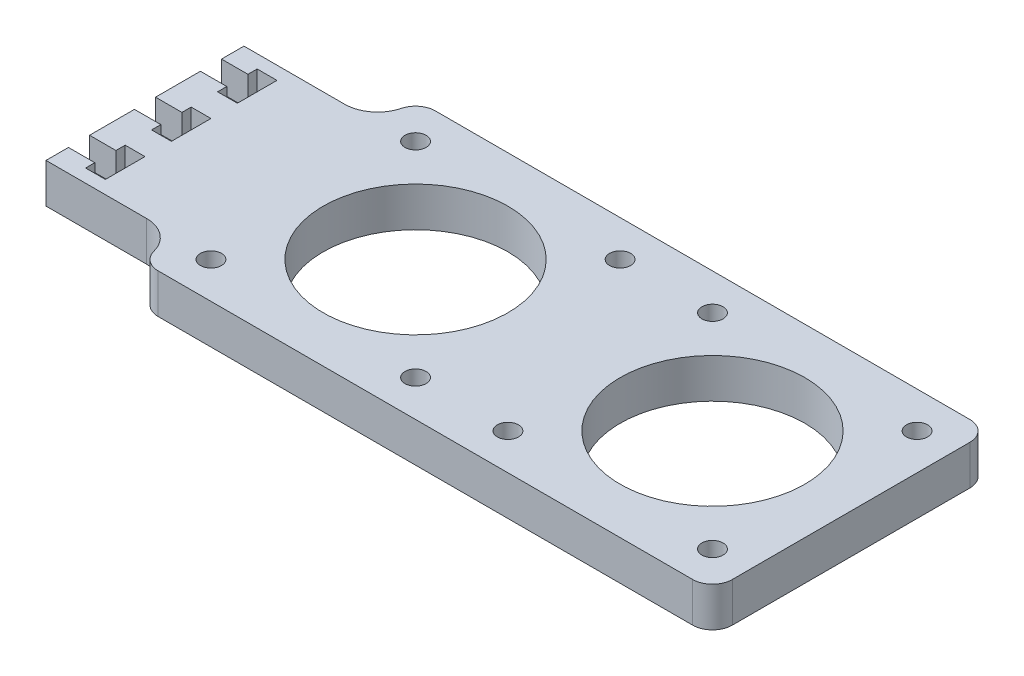
from build123d import *

# Parameters (mm, degrees)
SKETCH_1_W          = 20
SKETCH_1_H          = 30
EXTRUDE_1_DEPTH     = 6
SKETCH_2_W          = 4
SKETCH_2_H          = 3.2
CUT_EXTRUDE_1_DEPTH = 4.5
SKETCH_3_W          = 3
SKETCH_3_H          = 6
CUT_EXTRUDE_2_DEPTH = 14.5
SKETCH_4_W          = 87
SKETCH_4_H          = 42
SKETCH_4_R          = 1.6
SKETCH_4_R_2        = 14
EXTRUDE_2_DEPTH     = 6
FILLET_1_R          = 3
FILLET_2_R          = 5


with BuildPart() as part:
    # 草图1 → 凸台-拉伸1 (new body)
    with BuildSketch(Plane(origin=(0, 0, 0), x_dir=(1, 0, 0), z_dir=(0, 1, 0))):
        with Locations((10, 15)):
            Rectangle(SKETCH_1_W, SKETCH_1_H)
    extrude(amount=EXTRUDE_1_DEPTH)

    # 草图2 → 切除-拉伸1 (cut)
    with BuildSketch(Plane(origin=(0, 6, 0), x_dir=(1, 0, 0), z_dir=(0, 1, 0))):
        with Locations((2, 5)):
            Rectangle(SKETCH_2_W, SKETCH_2_H)
        with Locations((2, 15)):
            Rectangle(SKETCH_2_W, SKETCH_2_H)
        with Locations((2, 25)):
            Rectangle(SKETCH_2_W, SKETCH_2_H)
    extrude(amount=-CUT_EXTRUDE_1_DEPTH, mode=Mode.SUBTRACT)

    # 草图3 → 切除-拉伸2 (cut)
    with BuildSketch(Plane(origin=(0, 6, 0), x_dir=(1, 0, 0), z_dir=(0, 1, 0))):
        with Locations((5.5, 5)):
            Rectangle(SKETCH_3_W, SKETCH_3_H)
        with Locations((5.5, 15)):
            Rectangle(SKETCH_3_W, SKETCH_3_H)
        with Locations((5.5, 25)):
            Rectangle(SKETCH_3_W, SKETCH_3_H)
    extrude(amount=-CUT_EXTRUDE_2_DEPTH, mode=Mode.SUBTRACT)

    # 草图4 → 凸台-拉伸2 (add)
    with BuildSketch(Plane.XZ):
        with Locations((63.5, -15)):
            Rectangle(SKETCH_4_W, SKETCH_4_H)
        with Locations(Location((25.5, 0.5, 0), (0, 0, 270))):
            Circle(SKETCH_4_R, mode=Mode.SUBTRACT)
        with Locations(Location((25.5, -30.5, 0), (0, 0, 90))):
            Circle(SKETCH_4_R, mode=Mode.SUBTRACT)
        with Locations(Location((56.5, -30.5, 0), (0, 0, 90))):
            Circle(SKETCH_4_R, mode=Mode.SUBTRACT)
        with Locations(Location((56.5, 0.5, 0), (0, 0, 270))):
            Circle(SKETCH_4_R, mode=Mode.SUBTRACT)
        with Locations(Location((41, -15, 0), (0, 0, 270))):
            Circle(SKETCH_4_R_2, mode=Mode.SUBTRACT)
        with Locations(Location((86, -15, 0), (0, 0, 270))):
            Circle(SKETCH_4_R_2, mode=Mode.SUBTRACT)
        with Locations(Location((70.5, 0.5, 0), (0, 0, 270))):
            Circle(SKETCH_4_R, mode=Mode.SUBTRACT)
        with Locations(Location((101.5, 0.5, 0), (0, 0, 90))):
            Circle(SKETCH_4_R, mode=Mode.SUBTRACT)
        with Locations(Location((101.5, -30.5, 0), (0, 0, 270))):
            Circle(SKETCH_4_R, mode=Mode.SUBTRACT)
        with Locations(Location((70.5, -30.5, 0), (0, 0, 90))):
            Circle(SKETCH_4_R, mode=Mode.SUBTRACT)
    extrude(amount=-EXTRUDE_2_DEPTH)

    # 圆角1
    fillet_1_edges = [part.edges().sort_by_distance(p)[0] for p in [
        (20, 3, -36),
        (107, 3, 6),
        (107, 3, -36),
        (20, 3, 6),
    ]]
    fillet(fillet_1_edges, radius=FILLET_1_R)

    # 圆角2
    fillet_2_edges = [part.edges().sort_by_distance(p)[0] for p in [
        (20, 3, -30),
        (20, 3, 0),
    ]]
    fillet(fillet_2_edges, radius=FILLET_2_R)


solid = part.part
